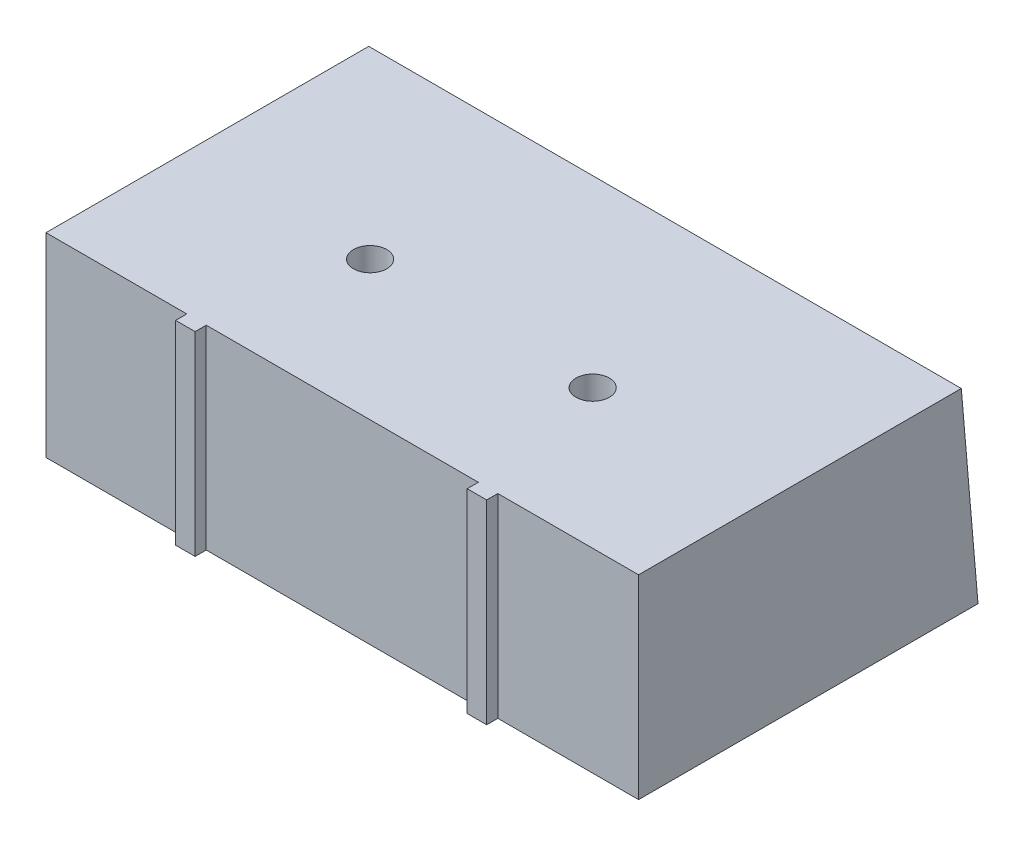
from build123d import *

# Parameters (mm, degrees)
SKETCH1_R               = 3
BOSS_EXTRUDE2_DEPTH     = 35
CUT_EXTRUDE1_DEPTH      = 128.625428501
CUT_EXTRUDE1_DEPTH_BACK = 128.625428501


with BuildPart() as part:
    # Sketch1 → Boss-Extrude2 (new body)
    with BuildSketch(Plane(origin=(0, 0, 0), x_dir=(1, 0, 0), z_dir=(0, 1, 0))):
        Polygon((0, 0), (25.3, 0), (25.3, -2), (28.8, -2), (28.8, 0), (77.7, 0), (77.7, -2), (81.2, -2), (81.2, 0), (106.5, 0), (106.5, 61), (0, 61), align=None)
        with Locations(Location((33.25, 25, 0), (0, 0, 270))):
            Circle(SKETCH1_R, mode=Mode.SUBTRACT)
        with Locations(Location((73.25, 25, 0), (0, 0, 90))):
            Circle(SKETCH1_R, mode=Mode.SUBTRACT)
    extrude(amount=BOSS_EXTRUDE2_DEPTH)

    # Sketch2 → Cut-Extrude1 (cut, two sides: drawn at the far end of the back side and taken through both)
    with BuildSketch(Plane.ZY.offset(-CUT_EXTRUDE1_DEPTH_BACK)):
        Polygon((-61, 35), (-58, 35), (-61, 0), align=None)
    extrude(amount=CUT_EXTRUDE1_DEPTH + CUT_EXTRUDE1_DEPTH_BACK, mode=Mode.SUBTRACT)


solid = part.part
